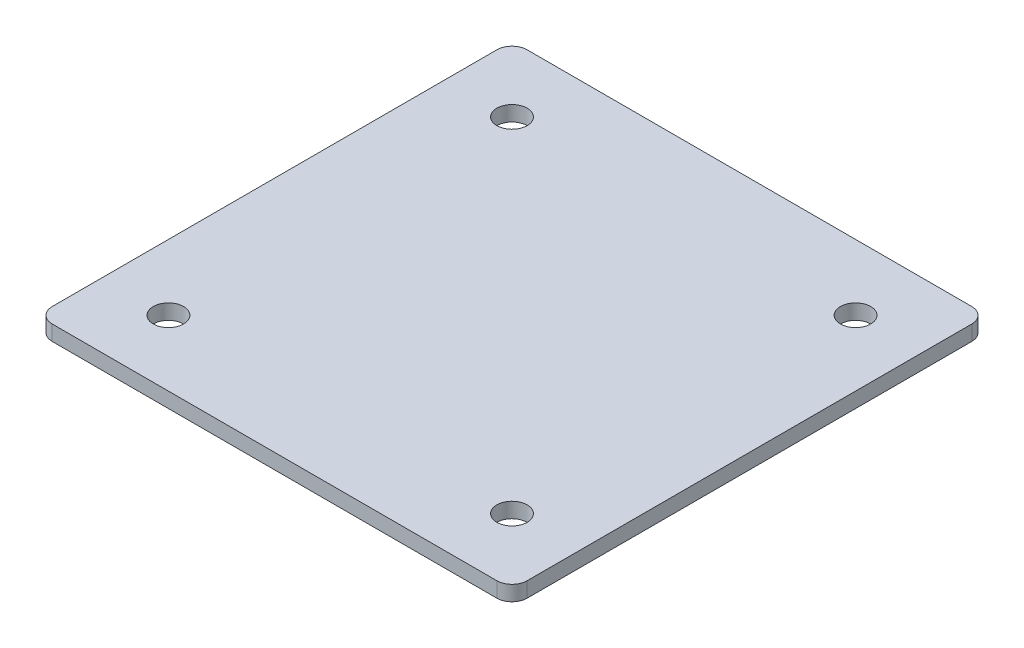
from build123d import *

# Parameters (mm, degrees)
SKETCH_1_R      = 1.5
EXTRUDE_1_DEPTH = 1.5


with BuildPart() as part:
    # Эскиз1 → Бобышка-Вытянуть1 (new body)
    with BuildSketch(Plane(origin=(0, 0, 0), x_dir=(1, 0, 0), z_dir=(0, 1, 0))):
        with BuildLine():
            Line((-22, 23.5), (22, 23.5))
            ThreePointArc((22, 23.5), (23.060660172, 23.060660172), (23.5, 22))
            Line((23.5, 22), (23.5, -22))
            ThreePointArc((23.5, -22), (23.060660172, -23.060660172), (22, -23.5))
            Line((22, -23.5), (-22, -23.5))
            ThreePointArc((-22, -23.5), (-23.060660172, -23.060660172), (-23.5, -22))
            Line((-23.5, -22), (-23.5, 22))
            ThreePointArc((-23.5, 22), (-23.060660172, 23.060660172), (-22, 23.5))
        make_face()
        with Locations(Location((-17, 17, 0), (0, 0, 270))):
            Circle(SKETCH_1_R, mode=Mode.SUBTRACT)
        with Locations(Location((17, 17, 0), (0, 0, 270))):
            Circle(SKETCH_1_R, mode=Mode.SUBTRACT)
        with Locations(Location((17, -17, 0), (0, 0, 270))):
            Circle(SKETCH_1_R, mode=Mode.SUBTRACT)
        with Locations(Location((-17, -17, 0), (0, 0, 270))):
            Circle(SKETCH_1_R, mode=Mode.SUBTRACT)
    extrude(amount=EXTRUDE_1_DEPTH)


solid = part.part
